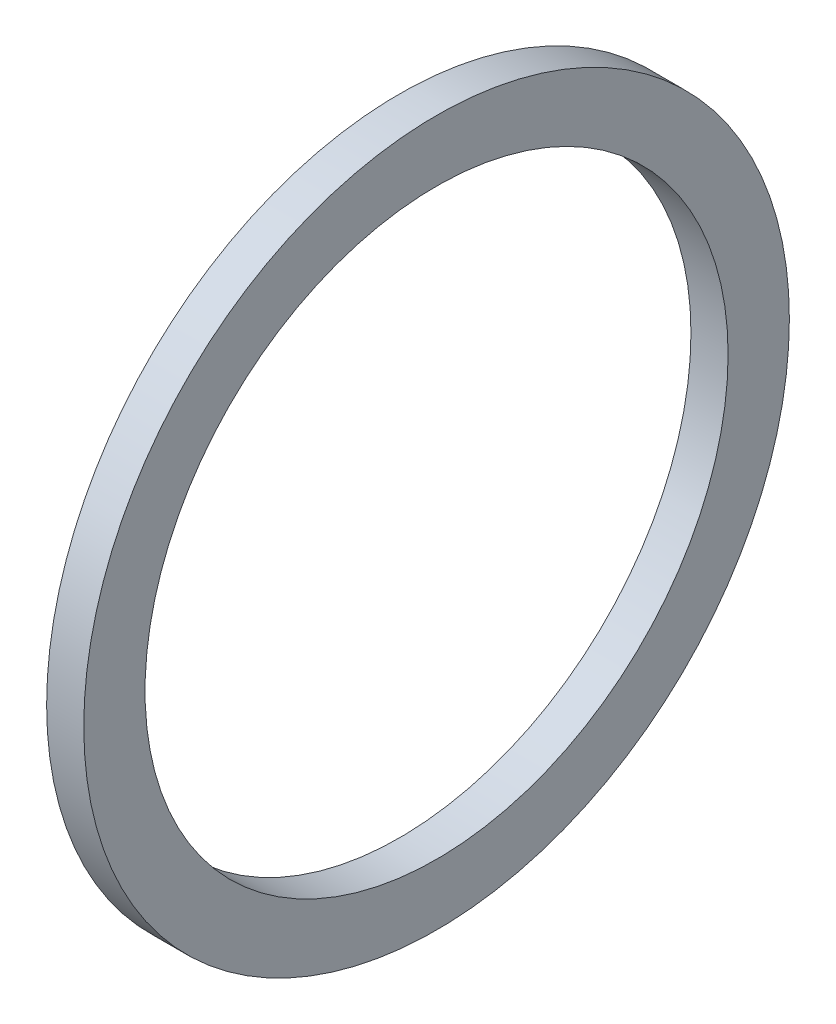
from build123d import *

# Parameters (mm, degrees)
SKETCH1_R           = 9.5
SKETCH1_R_2         = 7.85
BOSS_EXTRUDE1_DEPTH = 1


with BuildPart() as part:
    # Sketch1 → Boss-Extrude1 (new body)
    with BuildSketch(Plane(origin=(0, 0, 0), x_dir=(0, 0, -1), z_dir=(1, 0, 0))):
        Circle(SKETCH1_R)
        Circle(SKETCH1_R_2, mode=Mode.SUBTRACT)
    extrude(amount=BOSS_EXTRUDE1_DEPTH)


solid = part.part
